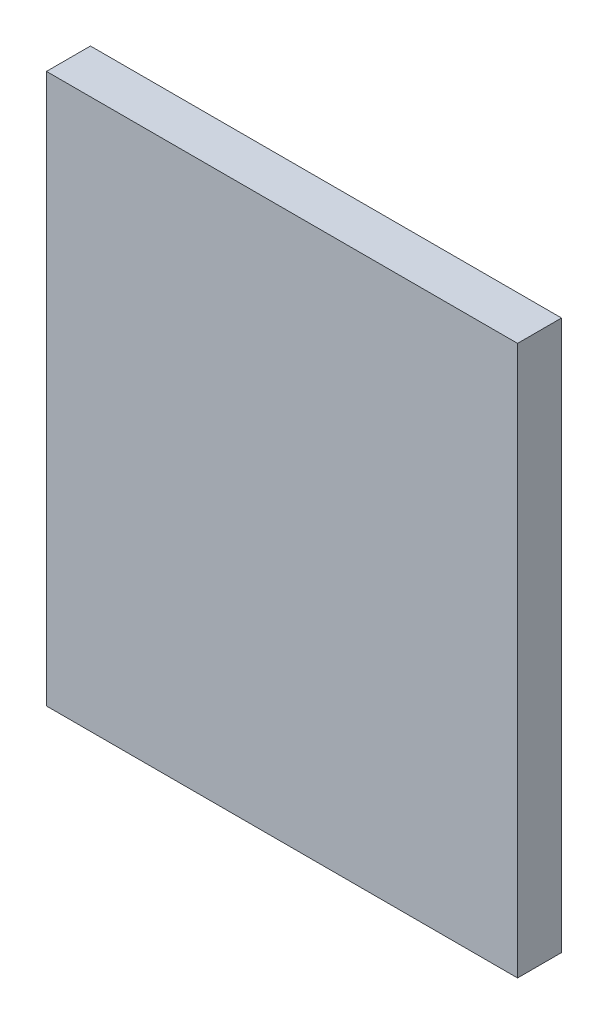
from build123d import *

# Parameters (mm, degrees)
SKETCH1_W           = 152.4
SKETCH1_H           = 177.8
BOSS_EXTRUDE1_DEPTH = 14.224


with BuildPart() as part:
    # Sketch1 → Boss-Extrude1 (new body)
    with BuildSketch(Plane.XY):
        Rectangle(SKETCH1_W, SKETCH1_H)
    extrude(amount=BOSS_EXTRUDE1_DEPTH)


solid = part.part
